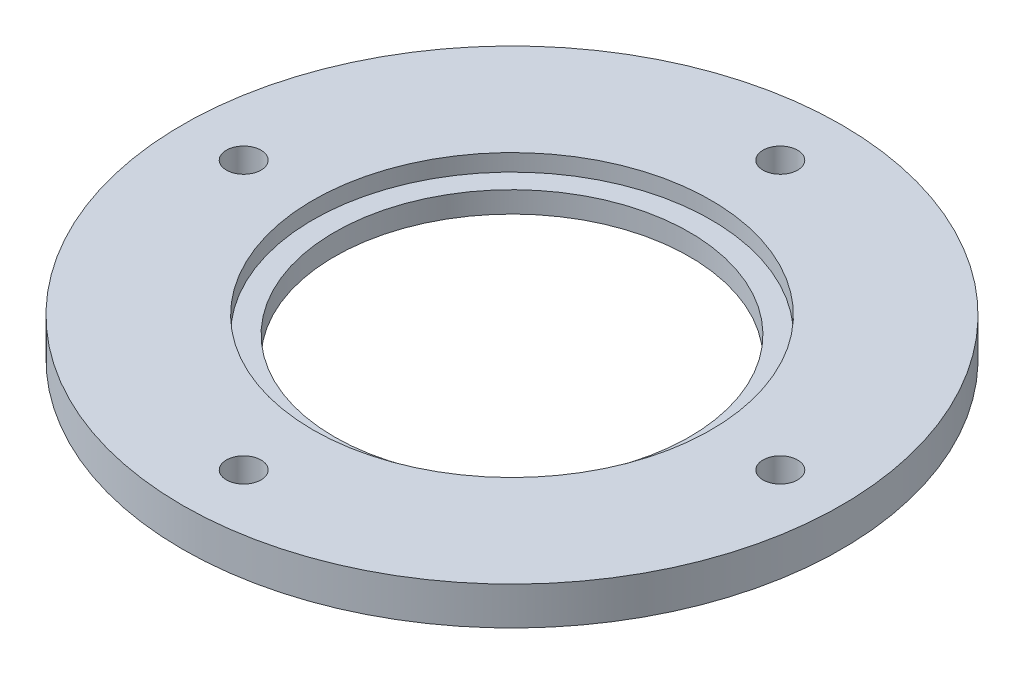
from build123d import *

# Parameters (mm, degrees)
SKETCH1_R           = 39
BOSS_EXTRUDE1_DEPTH = 4.5
SKETCH2_R           = 2.05
CUT_EXTRUDE1_DEPTH  = 4.5
SKETCH3_R           = 21
CUT_EXTRUDE2_DEPTH  = 4.5
SKETCH4_R           = 23.55
CUT_EXTRUDE3_DEPTH  = 2


with BuildPart() as part:
    # Sketch1 → Boss-Extrude1 (new body)
    with BuildSketch(Plane(origin=(0, 0, 0), x_dir=(1, 0, 0), z_dir=(0, 1, 0))):
        with Locations(Location((0, 0, 0), (0, 0, 270))):
            Circle(SKETCH1_R)
    extrude(amount=BOSS_EXTRUDE1_DEPTH)

    # Sketch2 → Cut-Extrude1 (cut)
    with BuildSketch(Plane(origin=(0, 4.5, 0), x_dir=(1, 0, 0), z_dir=(0, 1, 0))):
        with Locations(Location((31.75, 0, 0), (0, 0, 270))):
            Circle(SKETCH2_R)
        with Locations(Location((0, -31.75, 0), (0, 0, 270))):
            Circle(SKETCH2_R)
        with Locations(Location((-31.75, 0, 0), (0, 0, 270))):
            Circle(SKETCH2_R)
        with Locations(Location((0, 31.75, 0), (0, 0, 270))):
            Circle(SKETCH2_R)
    extrude(amount=-CUT_EXTRUDE1_DEPTH, mode=Mode.SUBTRACT)

    # Sketch3 → Cut-Extrude2 (cut)
    with BuildSketch(Plane(origin=(0, 4.5, 0), x_dir=(1, 0, 0), z_dir=(0, 1, 0))):
        with Locations(Location((0, 0, 0), (0, 0, 270))):
            Circle(SKETCH3_R)
    extrude(amount=-CUT_EXTRUDE2_DEPTH, mode=Mode.SUBTRACT)

    # Sketch4 → Cut-Extrude3 (cut)
    with BuildSketch(Plane(origin=(0, 4.5, 0), x_dir=(1, 0, 0), z_dir=(0, 1, 0))):
        with Locations(Location((0, 0, 0), (0, 0, 270))):
            Circle(SKETCH4_R)
    extrude(amount=-CUT_EXTRUDE3_DEPTH, mode=Mode.SUBTRACT)


solid = part.part
